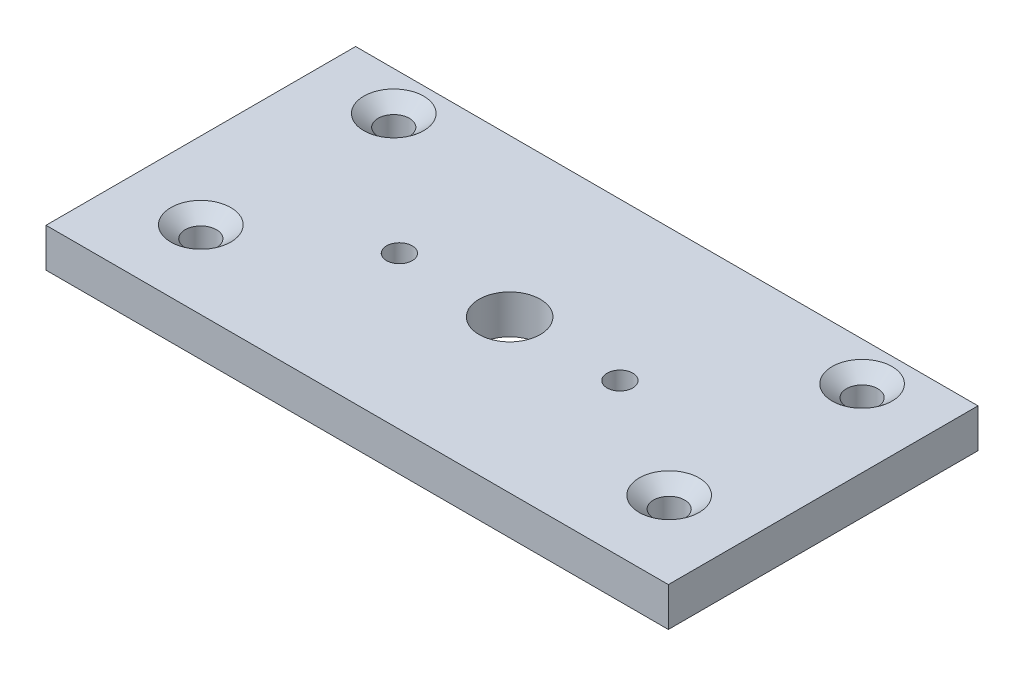
from build123d import *

# Parameters (mm, degrees)
SKETCH1_W                                            = 101.6
SKETCH1_H                                            = 50.546
BASE_DEPTH                                           = 6.35
BEARING_BLOCK_BOLT_HOLE_PATTERN_D                    = 4.2
SHAFT_CLEARANCE_HOLE_D                               = 10
PLATE_MOUNTING_WOOD_SCREW_CLEARANCE_HOLE_D           = 5.1054
PLATE_MOUNTING_WOOD_SCREW_CLEARANCE_HOLE_CSINK_D     = 9.779
PLATE_MOUNTING_WOOD_SCREW_CLEARANCE_HOLE_CSINK_ANGLE = 100


with BuildPart() as part:
    # Sketch1 → base (new body)
    with BuildSketch(Plane(origin=(0, 0, 0), x_dir=(1, 0, 0), z_dir=(0, 1, 0))):
        with Locations((50.8, 25.273)):
            Rectangle(SKETCH1_W, SKETCH1_H)
    extrude(amount=BASE_DEPTH)

    # bearing_block_bolt_hole_pattern (through all)
    with Locations(Plane(origin=(0, 6.35, 0), x_dir=(1, 0, 0), z_dir=(0, 1, 0))):
        with Locations((32.800036, 24.892), (68.799964, 24.892)):
            Hole(BEARING_BLOCK_BOLT_HOLE_PATTERN_D / 2)

    # shaft_clearance_hole (through all)
    with Locations(Plane(origin=(0, 6.35, 0), x_dir=(1, 0, 0), z_dir=(0, 1, 0))):
        with Locations((50.8, 24.892)):
            Hole(SHAFT_CLEARANCE_HOLE_D / 2)

    # plate_mounting_wood_screw_clearance_holes (through all)
    with Locations(Plane(origin=(0, 6.35, 0), x_dir=(1, 0, 0), z_dir=(0, 1, 0))):
        with Locations((12.573, 44.196), (89.027, 12.7), (12.573, 12.7), (89.027, 44.196)):
            CounterSinkHole(PLATE_MOUNTING_WOOD_SCREW_CLEARANCE_HOLE_D / 2, PLATE_MOUNTING_WOOD_SCREW_CLEARANCE_HOLE_CSINK_D / 2, counter_sink_angle=PLATE_MOUNTING_WOOD_SCREW_CLEARANCE_HOLE_CSINK_ANGLE)


solid = part.part
